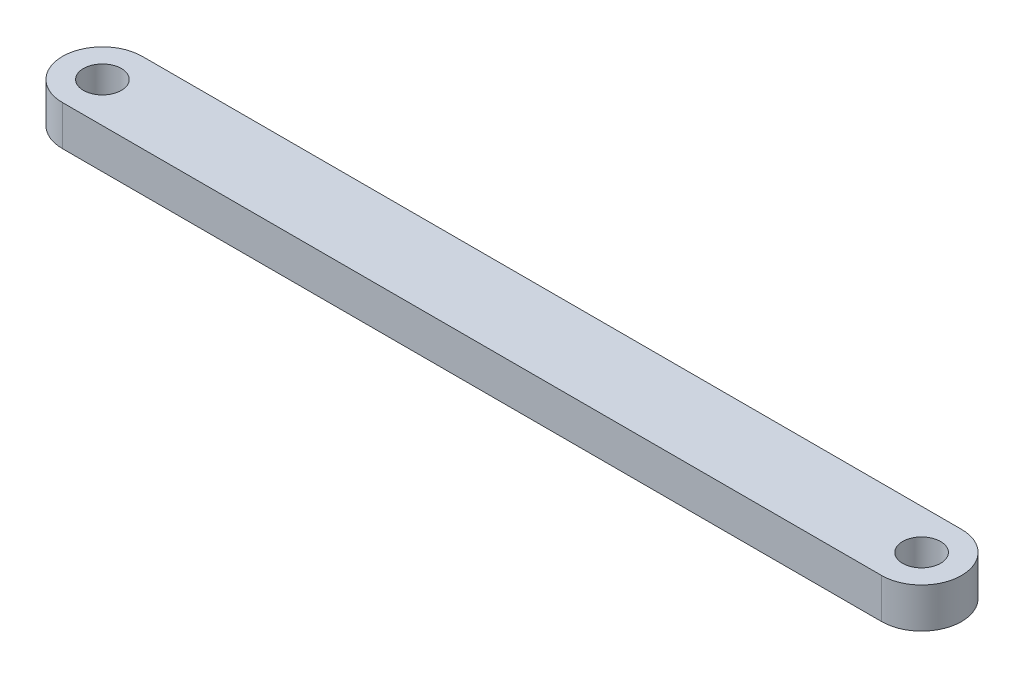
from build123d import *

# Parameters (mm, degrees)
SKETCH1_R           = 0.95
BOSS_EXTRUDE1_DEPTH = 2


with BuildPart() as part:
    # Sketch1 → Boss-Extrude1 (new body)
    with BuildSketch(Plane(origin=(0, 0, 0), x_dir=(1, 0, 0), z_dir=(0, 1, 0))):
        with BuildLine():
            Line((0, 2), (41, 2))
            ThreePointArc((41, 2), (43, 0), (41, -2))
            Line((41, -2), (0, -2))
            ThreePointArc((0, -2), (-2, 0), (0, 2))
        make_face()
        with Locations(Location((0, 0, 0), (0, 0, 270))):
            Circle(SKETCH1_R, mode=Mode.SUBTRACT)
        with Locations(Location((41, 0, 0), (0, 0, 270))):
            Circle(SKETCH1_R, mode=Mode.SUBTRACT)
    extrude(amount=BOSS_EXTRUDE1_DEPTH)


solid = part.part
